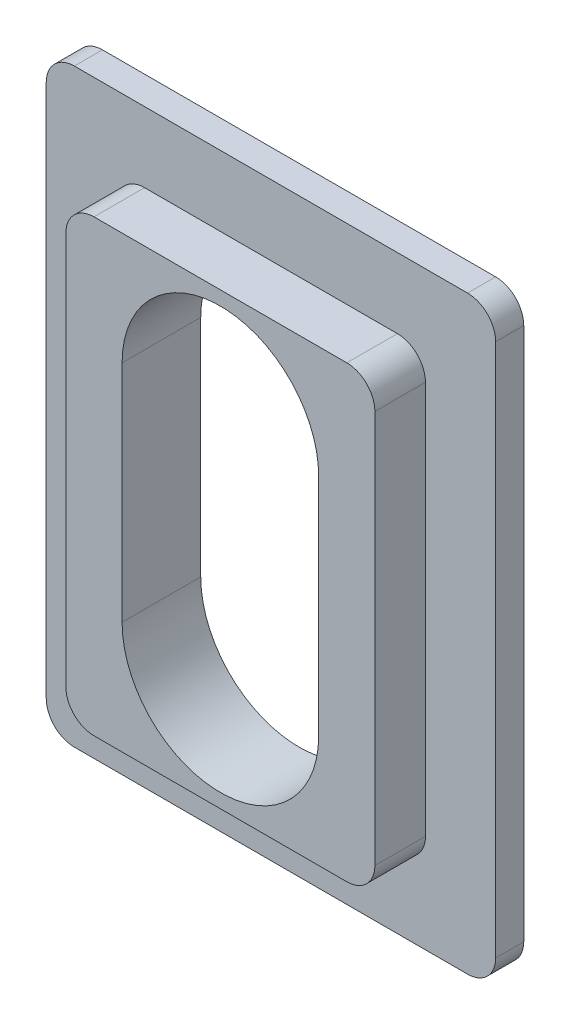
from build123d import *

# Parameters (mm, degrees)
RESSALTO_EXTRUS_O1_DEPTH = 1
RESSALTO_EXTRUS_O3_DEPTH = 2.8


with BuildPart() as part:
    # Esboço1 → Ressalto-extrusão1 (new body)
    with BuildSketch(Plane.XY):
        with BuildLine():
            ThreePointArc((0, 1), (0.292893219, 0.292893219), (1, 0))
            Line((1, 0), (15, 0))
            ThreePointArc((15, 0), (15.707106781, 0.292893219), (16, 1))
            Line((16, 1), (16, 20))
            ThreePointArc((16, 20), (15.707106781, 20.707106781), (15, 21))
            Line((15, 21), (1, 21))
            ThreePointArc((1, 21), (0.292893219, 20.707106781), (0, 20))
            Line((0, 20), (0, 1))
        make_face()
        with BuildLine():
            ThreePointArc((11.5, 6.5), (8, 3), (4.5, 6.5))
            Line((4.5, 6.5), (4.5, 14.5))
            ThreePointArc((4.5, 14.5), (8, 18), (11.5, 14.5))
            Line((11.5, 14.5), (11.5, 6.5))
        make_face(mode=Mode.SUBTRACT)
    extrude(amount=RESSALTO_EXTRUS_O1_DEPTH)

    # Esboço1<4> → Ressalto-extrusão3 (add)
    with BuildSketch(Plane.XY):
        with BuildLine():
            ThreePointArc((2.5, 3.5), (2.792893219, 2.792893219), (3.5, 2.5))
            Line((3.5, 2.5), (12.5, 2.5))
            ThreePointArc((12.5, 2.5), (13.207106781, 2.792893219), (13.5, 3.5))
            Line((13.5, 3.5), (13.5, 17.5))
            ThreePointArc((13.5, 17.5), (13.207106781, 18.207106781), (12.5, 18.5))
            Line((12.5, 18.5), (3.5, 18.5))
            ThreePointArc((3.5, 18.5), (2.792893219, 18.207106781), (2.5, 17.5))
            Line((2.5, 17.5), (2.5, 3.5))
        make_face()
        with BuildLine():
            ThreePointArc((11.5, 6.5), (8, 3), (4.5, 6.5))
            Line((4.5, 6.5), (4.5, 14.5))
            ThreePointArc((4.5, 14.5), (8, 18), (11.5, 14.5))
            Line((11.5, 14.5), (11.5, 6.5))
        make_face(mode=Mode.SUBTRACT)
    extrude(amount=RESSALTO_EXTRUS_O3_DEPTH)


solid = part.part
